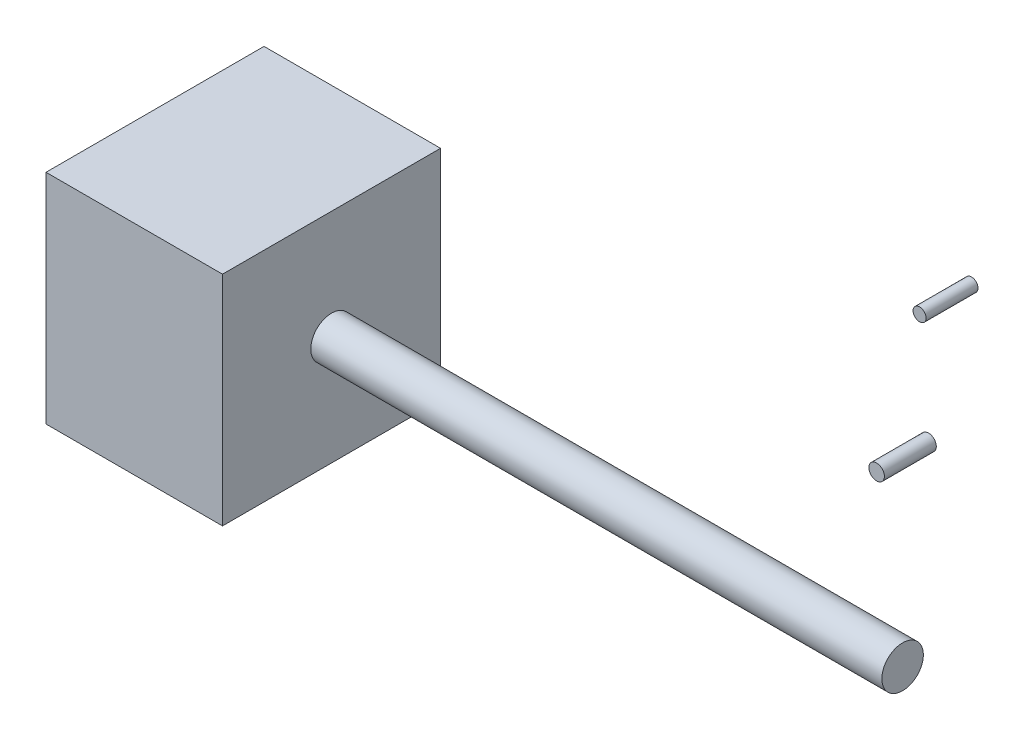
from build123d import *

# Parameters (mm, degrees)
SKETCH_1_W          = 42
SKETCH_1_H          = 42
EXTRUDE_1_DEPTH     = 44
SKETCH_2_R          = 4
EXTRUDE_2_DEPTH     = 100
SKETCH_5_R          = 1.5
EXTRUDE_3_DEPTH     = 5
SKETCH_6_R          = 1.25
EXTRUDE_4_DEPTH     = 5
SKETCH_1_2_W        = 42
SKETCH_1_2_H        = 42
CUT_EXTRUDE_1_DEPTH = 10
SKETCH_2_2_R        = 4
EXTRUDE_5_DEPTH     = 20


with BuildPart() as part:
    # 草图1 → 凸台-拉伸1 (new body)
    with BuildSketch(Plane(origin=(0, 0, 0), x_dir=(0, 0, -1), z_dir=(1, 0, 0))):
        Rectangle(SKETCH_1_W, SKETCH_1_H)
    extrude(amount=-EXTRUDE_1_DEPTH)

    # 草图2 → 凸台-拉伸2 (add)
    with BuildSketch(Plane(origin=(0, 0, 0), x_dir=(0, 0, -1), z_dir=(1, 0, 0))):
        Circle(SKETCH_2_R)
    extrude(amount=EXTRUDE_2_DEPTH)

    # 草图1<2> → 切除-拉伸1 (cut)
    with BuildSketch(Plane(origin=(0, 0, 0), x_dir=(0, 0, -1), z_dir=(1, 0, 0))):
        Rectangle(SKETCH_1_2_W, SKETCH_1_2_H)
    extrude(amount=-CUT_EXTRUDE_1_DEPTH, mode=Mode.SUBTRACT)


with BuildPart() as body_2:
    # 草图5 → 凸台-拉伸3 (new, symmetric)
    with BuildSketch(Plane.XY):
        with Locations((100, 35)):
            Circle(SKETCH_5_R)
    extrude(amount=EXTRUDE_3_DEPTH, both=True)


with BuildPart() as body_3:
    # 草图6 → 凸台-拉伸4 (new, symmetric)
    with BuildSketch(Plane.XY):
        with Locations((108.27716468, 65.429340608)):
            Circle(SKETCH_6_R)
    extrude(amount=EXTRUDE_4_DEPTH, both=True)


with BuildPart() as cut_extrude_1_piece_1:
    # of the separate pieces the step leaves, piece 1, a body of its own (cut_extrude_1_pieces)
    add(part.part.solids().sort_by_distance((-10, -21, 21))[0])



with BuildPart() as cut_extrude_1_piece_2:
    # of the separate pieces the step leaves, piece 2, a body of its own (cut_extrude_1_pieces)
    add(part.part.solids().sort_by_distance((0, 0, -4))[0])


with BuildPart() as cut_extrude_1_piece_1_1:
    add(cut_extrude_1_piece_1.part)

    add(cut_extrude_1_piece_2.part)  # 凸台-拉伸5 merges 切除-拉伸1 piece 2
    # 草图2<2> → 凸台-拉伸5 (add)
    with BuildSketch(Plane(origin=(0, 0, 0), x_dir=(0, 0, -1), z_dir=(1, 0, 0))):
        Circle(SKETCH_2_2_R)
    extrude(amount=-EXTRUDE_5_DEPTH)


solid = Compound([body_2.part, body_3.part, cut_extrude_1_piece_1_1.part])
